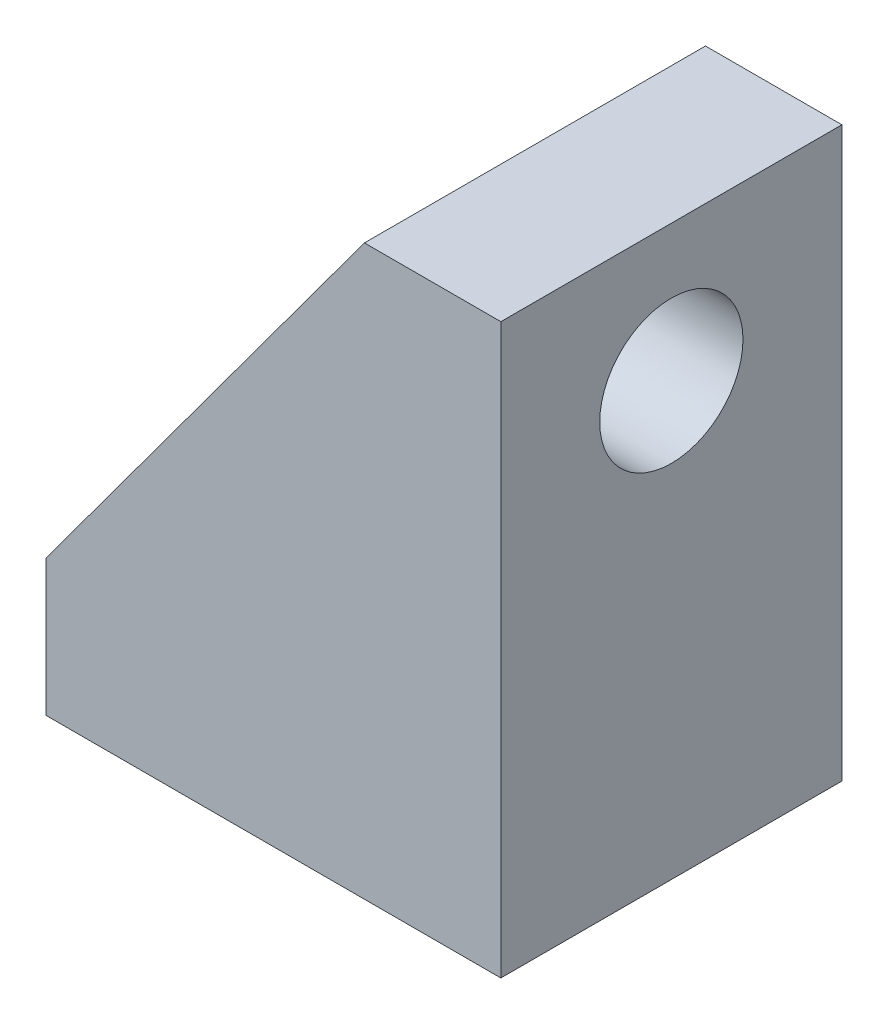
from build123d import *

# Parameters (mm, degrees)
BOSS_EXTRUDE2_DEPTH = 15
SKETCH4_R           = 3.15
CUT_EXTRUDE1_DEPTH  = 46.776415929
SKETCH4_3_R         = 5.5
SKETCH4_3_R_2       = 3.15
CUT_EXTRUDE2_DEPTH  = 14
SKETCH6_R           = 3.15
CUT_EXTRUDE3_DEPTH  = 49.171363436
SKETCH6_3_R         = 5.5
SKETCH6_3_R_2       = 3.15
CUT_EXTRUDE4_DEPTH  = 32.34684153


with BuildPart() as part:
    # Sketch3 → Boss-Extrude2 (new body)
    with BuildSketch(Plane.XY):
        Polygon((18.34684153, 0), (38.34684153, 0), (38.34684153, 25), (32.34684153, 25), (18.34684153, 6), align=None)
    extrude(amount=BOSS_EXTRUDE2_DEPTH)

    # Sketch4 → Cut-Extrude1 (cut, through all)
    with BuildSketch(Plane(origin=(0, 20, 0), x_dir=(1, 0, 0), z_dir=(0, 1, 0))):
        with Locations(Location((25.27040153, -7.5, 0), (0, 0, 270))):
            Circle(SKETCH4_R)
    extrude(amount=-CUT_EXTRUDE1_DEPTH, mode=Mode.SUBTRACT)

    # Sketch4<3> → Cut-Extrude2 (cut)
    with BuildSketch(Plane(origin=(0, 20, 0), x_dir=(1, 0, 0), z_dir=(0, 1, 0))):
        with Locations(Location((25.27040153, -7.5, 0), (0, 0, 270))):
            Circle(SKETCH4_3_R)
        with Locations(Location((25.27040153, -7.5, 0), (0, 0, 270))):
            Circle(SKETCH4_3_R_2, mode=Mode.SUBTRACT)
    extrude(amount=-CUT_EXTRUDE2_DEPTH, mode=Mode.SUBTRACT)

    # Sketch6 → Cut-Extrude3 (cut, through all)
    with BuildSketch(Plane(origin=(0, 0, 0), x_dir=(0, 0, -1), z_dir=(1, 0, 0))):
        with Locations(Location((-7.5, 19, 0), (0, 0, 161.490595018))):
            Circle(SKETCH6_R)
    extrude(amount=CUT_EXTRUDE3_DEPTH, mode=Mode.SUBTRACT)

    # Sketch6<3> → Cut-Extrude4 (cut)
    with BuildSketch(Plane(origin=(0, 0, 0), x_dir=(0, 0, -1), z_dir=(1, 0, 0))):
        with Locations(Location((-7.5, 19, 0), (0, 0, 180))):
            Circle(SKETCH6_3_R)
        with Locations(Location((-7.5, 19, 0), (0, 0, 180))):
            Circle(SKETCH6_3_R_2, mode=Mode.SUBTRACT)
    extrude(amount=CUT_EXTRUDE4_DEPTH, mode=Mode.SUBTRACT)


solid = part.part
